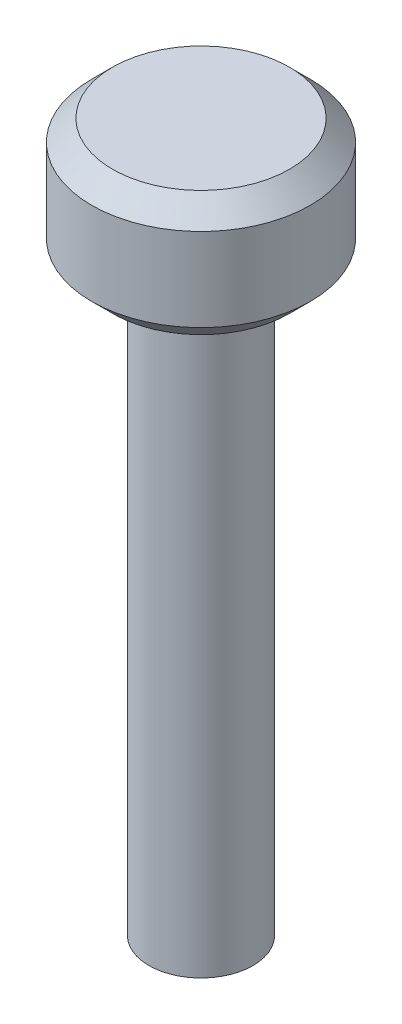
from build123d import *


with BuildPart() as part:
    # Sketch2 → Revolve1 (revolve)
    with BuildSketch(Plane.XY, mode=Mode.PRIVATE) as revolve1_sk:
        Polygon((0, 34), (-4.25, 34), (-5.25, 33), (-5.25, 29), (-4.25, 28), (-2.5, 28), (-2.5, 0), (0, 0.295692584), align=None)
    revolve(revolve1_sk.sketch.rotate(Axis((0, 0.295692584, 0), (0, 1, 0)), 180), axis=Axis((0, 0.295692584, 0), (0, 1, 0)))


solid = part.part
